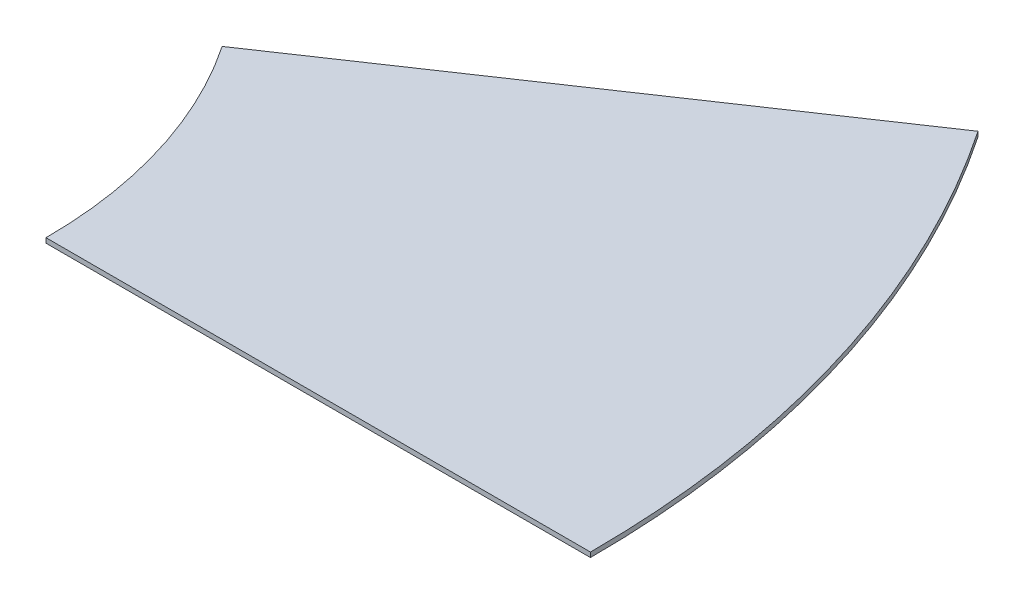
from build123d import *

# Parameters (mm, degrees)
EXTRUDE_1_DEPTH = 0.53


with BuildPart() as part:
    # 草图1 → 凸台-拉伸1 (new body)
    with BuildSketch(Plane(origin=(0, 0, 0), x_dir=(1, 0, 0), z_dir=(0, 1, 0))):
        with BuildLine():
            Line((91.194132981, 61.511219382), (41.451878628, 27.959645174))
            ThreePointArc((41.451878628, 27.959645174), (47.815237798, 14.618585236), (50, 0))
            Line((50, 0), (110, 0))
            ThreePointArc((110, 0), (105.193523156, 32.16088752), (91.194132981, 61.511219382))
        make_face()
    extrude(amount=EXTRUDE_1_DEPTH)


solid = part.part
